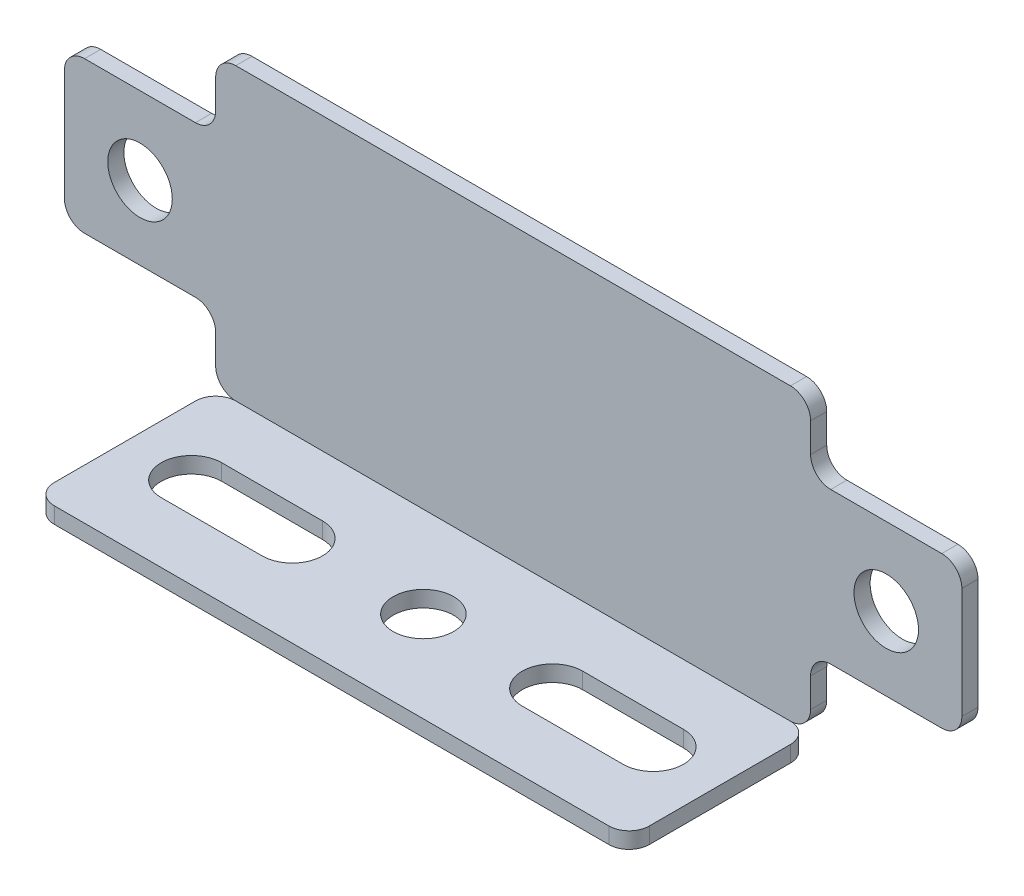
from build123d import *

# Parameters (mm, degrees)
BOSS_EXTRU_1_DEPTH                  = 0.8
CONG_2_R                            = 1
DIAM_TRE_DU_PER_AGE_3_2_3_2_1_D     = 3.2
DIAM_TRE_DU_PER_AGE_3_2_3_2_1_DEPTH = 8
DIAM_TRE_DU_PER_AGE_3_2_3_2_1_TIP   = 0.96137699
ESQUISSE4_W                         = 29.5
ESQUISSE4_H                         = 0.8
BOSS_EXTRU_2_DEPTH                  = 9
CONG_3_R                            = 1
ESQUISSE5_R                         = 1.5
ENL_V_MAT_EXTRU_1_DEPTH             = 9


with BuildPart() as part:
    # Esquisse1 → Boss.-Extru.1 (new body)
    with BuildSketch(Plane.XY):
        Polygon((0, 0), (0, 7.5), (7.5, 7.5), (7.5, 10.95), (37, 10.95), (37, 7.5), (44.5, 7.5), (44.5, 0), (37, 0), (37, -3.45), (7.5, -3.45), (7.5, 0), align=None)
    extrude(amount=BOSS_EXTRU_1_DEPTH)

    # Congé2
    cong_2_edges = [part.edges().sort_by_distance(p)[0] for p in [
        (0, 0, 0.4),
        (0, 7.5, 0.4),
        (7.5, 7.5, 0.4),
        (7.5, 10.95, 0.4),
        (37, 10.95, 0.4),
        (37, 7.5, 0.4),
        (44.5, 7.5, 0.4),
        (44.5, 0, 0.4),
        (37, 0, 0.4),
        (37, -3.45, 0.4),
        (7.5, -3.45, 0.4),
        (7.5, 0, 0.4),
    ]]
    fillet(cong_2_edges, radius=CONG_2_R)

    # Diamètre du perçage Ø3.2 (3.2)1
    with Locations(Plane.XY.offset(0.8)):
        with Locations((3.75, 3.65), (40.75, 3.65)):
            Hole(DIAM_TRE_DU_PER_AGE_3_2_3_2_1_D / 2, depth=DIAM_TRE_DU_PER_AGE_3_2_3_2_1_DEPTH)
            with Locations((0, 0, -(DIAM_TRE_DU_PER_AGE_3_2_3_2_1_DEPTH + DIAM_TRE_DU_PER_AGE_3_2_3_2_1_TIP / 2))):  # 118° drill point
                Cone(0, DIAM_TRE_DU_PER_AGE_3_2_3_2_1_D / 2, DIAM_TRE_DU_PER_AGE_3_2_3_2_1_TIP, mode=Mode.SUBTRACT)


with BuildPart() as body_2:
    # Esquisse4 → Boss.-Extru.2 (new body)
    with BuildSketch(Plane.XY.offset(0.8)):
        with Locations((22.25, -3.85)):
            Rectangle(ESQUISSE4_W, ESQUISSE4_H)
    extrude(amount=BOSS_EXTRU_2_DEPTH)

    # Congé3
    cong_3_edges = [body_2.edges().sort_by_distance(p)[0] for p in [
        (37, -3.85, 9.8),
        (7.5, -3.85, 9.8),
        (37, -3.85, 0.8),
        (7.5, -3.85, 0.8),
    ]]
    fillet(cong_3_edges, radius=CONG_3_R)

    # Esquisse5 → Enlèv. mat.-Extru.1 (cut)
    with BuildSketch(Plane(origin=(0, -3.45, 0), x_dir=(1, 0, 0), z_dir=(0, 1, 0))):
        with Locations(Location((22.3, -5.3, 0), (0, 0, 180))):
            Circle(ESQUISSE5_R)
        with BuildLine():
            Line((10.8, -3.8), (15.8, -3.8))
            ThreePointArc((15.8, -3.8), (17.3, -5.3), (15.8, -6.8))
            Line((15.8, -6.8), (10.8, -6.8))
            ThreePointArc((10.8, -6.8), (9.3, -5.3), (10.8, -3.8))
        make_face()
        with BuildLine():
            Line((28.7, -3.8), (33.7, -3.8))
            ThreePointArc((33.7, -3.8), (35.2, -5.3), (33.7, -6.8))
            Line((33.7, -6.8), (28.7, -6.8))
            ThreePointArc((28.7, -6.8), (27.2, -5.3), (28.7, -3.8))
        make_face()
    extrude(amount=-ENL_V_MAT_EXTRU_1_DEPTH, mode=Mode.SUBTRACT)


solid = Compound([part.part, body_2.part])
